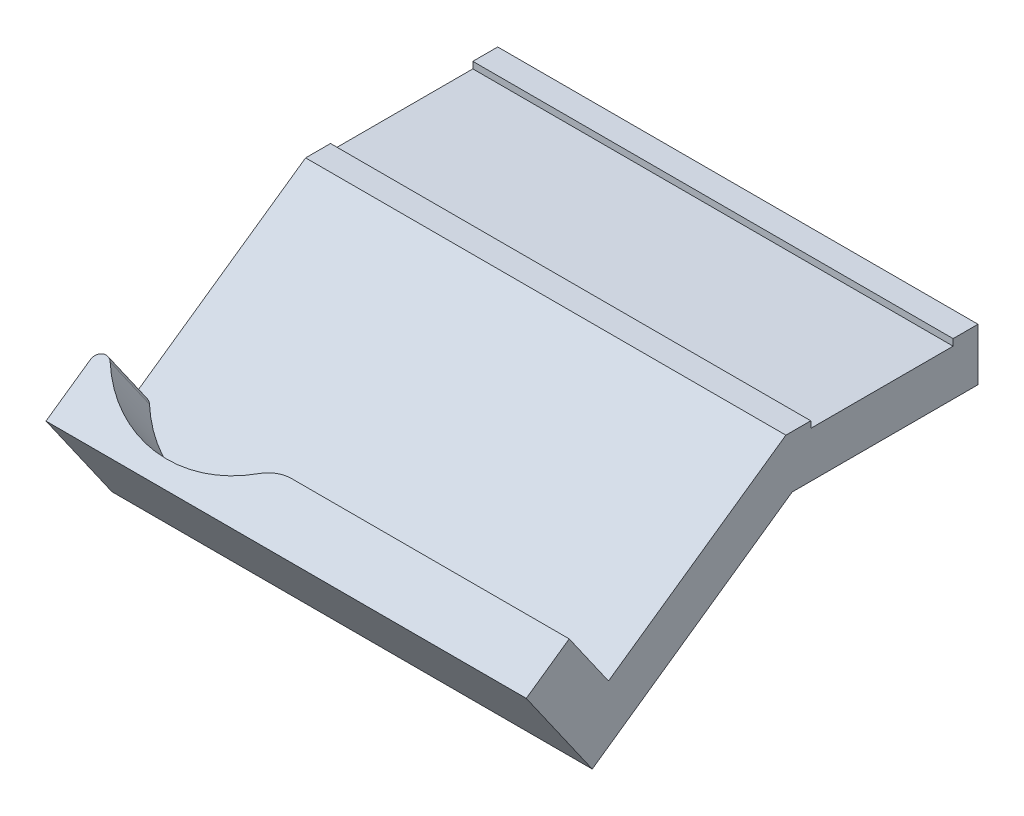
from build123d import *

# Parameters (mm, degrees)
SKETCH1_W           = 55
SKETCH1_H           = 33
BOSS_EXTRUDE1_DEPTH = 50
CUT_EXTRUDE1_DEPTH  = 50
CUT_EXTRUDE2_DEPTH  = 82.326502445
BOSS_EXTRUDE2_REACH = 83.327
SKETCH6_R           = 13.75
CUT_EXTRUDE3_DEPTH  = 81.295894003
CUT_EXTRUDE4_DEPTH  = 82.326502445
SKETCH8_R           = 6
CUT_EXTRUDE5_DEPTH  = 71.068140857
CUT_EXTRUDE6_DEPTH  = 71.068140857
SKETCH10_W          = 55
SKETCH10_H          = 4.5
CUT_EXTRUDE7_DEPTH  = 69.860192199
FILLET5_R           = 1
FILLET6_R           = 5
CUT_EXTRUDE8_DEPTH  = 67.820476425
SKETCH17_W          = 55
SKETCH17_H          = 6
BOSS_EXTRUDE4_DEPTH = 22
BOSS_EXTRUDE5_DEPTH = 55
SKETCH19_W          = 55
SKETCH19_H          = 16.3
CUT_EXTRUDE9_DEPTH  = 0.75
BOSS_EXTRUDE6_DEPTH = 55


with BuildPart() as part:
    # Sketch1 → Boss-Extrude1 (new body)
    with BuildSketch(Plane(origin=(0, 0, 0), x_dir=(1, 0, 0), z_dir=(0, 1, 0))):
        with Locations((27.5, 16.5)):
            Rectangle(SKETCH1_W, SKETCH1_H)
    extrude(amount=BOSS_EXTRUDE1_DEPTH)

    # Sketch4 → Cut-Extrude1 (cut)
    with BuildSketch(Plane(origin=(55, 0, 0), x_dir=(0, 0, -1), z_dir=(1, 0, 0))):
        Polygon((-21.678821818, 50.957602214), (19.278780397, 79.636424032), (47.957602214, 38.678821818), (7, 10), align=None)
    extrude(amount=-CUT_EXTRUDE1_DEPTH, mode=Mode.SUBTRACT)

    # Sketch5 → Cut-Extrude2 (cut, through all)
    with BuildSketch(Plane(origin=(55, 0, 0), x_dir=(0, 0, -1), z_dir=(1, 0, 0))):
        Polygon((-11.427284806, 18.88242211), (-3.235764364, 24.618186473), (2.5, 16.42666603), (-5.691520443, 10.690901667), align=None)
    extrude(amount=-CUT_EXTRUDE2_DEPTH, mode=Mode.SUBTRACT)

    # Sketch12 → Boss-Extrude2 (add, up to next)
    with BuildSketch(Plane(origin=(55, 0, 0), x_dir=(0, 0, -1), z_dir=(1, 0, 0)), mode=Mode.PRIVATE) as boss_extrude2_sk1:
        Polygon((2.5, 16.42666603), (7, 10), (8.187770464, 10.831685833), (3.687770464, 17.258351863), align=None)
    boss_extrude2_tool1 = extrude(boss_extrude2_sk1.sketch, amount=-BOSS_EXTRUDE2_REACH, mode=Mode.PRIVATE) - part.part
    add(boss_extrude2_tool1.solids().sort_by_distance((55, 13.629176, -5.343885))[0])

    # Sketch6 → Cut-Extrude3 (cut, through all)
    with BuildSketch(Plane(origin=(0, 3.421176544, 2.395533606), x_dir=(1, 0, 0), z_dir=(0, 0.8191520442889949, 0.5735764363510418))):
        with Locations((12, 22.917892202)):
            Circle(SKETCH6_R)
    extrude(amount=CUT_EXTRUDE3_DEPTH, mode=Mode.SUBTRACT)

    # Sketch7 → Cut-Extrude4 (cut, through all)
    with BuildSketch(Plane(origin=(55, 0, 0), x_dir=(0, 0, -1), z_dir=(1, 0, 0))):
        Polygon((0, 14.676147185), (6.378851002, 19.142666742), (10.878851002, 12.716000711), (85.085630618, 64.676147185), (25.408423261, 64.676147185), (0, 64.676147185), align=None)
    extrude(amount=-CUT_EXTRUDE4_DEPTH, mode=Mode.SUBTRACT)

    # Sketch8 → Cut-Extrude5 (cut, through all)
    with BuildSketch(Plane(origin=(0, 0, 0), x_dir=(1, 0, 0), z_dir=(0, 1, 0))):
        with Locations((25.75, 34.5)):
            Circle(SKETCH8_R)
    extrude(amount=CUT_EXTRUDE5_DEPTH, mode=Mode.SUBTRACT)

    # Sketch9 → Cut-Extrude6 (cut, through all)
    with BuildSketch(Plane(origin=(55, 0, 0), x_dir=(0, 0, -1), z_dir=(1, 0, 0))):
        Polygon((28.5, 25.054462072), (33, 25.054462072), (33, 28.205395993), align=None)
    extrude(amount=-CUT_EXTRUDE6_DEPTH, mode=Mode.SUBTRACT)

    # Sketch10 → Cut-Extrude7 (cut, through all)
    with BuildSketch(Plane(origin=(0, 0, 0), x_dir=(1, 0, 0), z_dir=(0, 1, 0))):
        with Locations((27.5, 30.75)):
            Rectangle(SKETCH10_W, SKETCH10_H)
    extrude(amount=CUT_EXTRUDE7_DEPTH, mode=Mode.SUBTRACT)

    # Fillet5
    fillet5_edges = [part.edges().sort_by_distance(p)[0] for p in [
        (0, 15.929333726, -8.628851002),
    ]]
    fillet(fillet5_edges, radius=FILLET5_R)

    # Fillet6
    fillet6_edges = [part.edges().sort_by_distance(p)[0] for p in [
        (21.439344558, 14.045018848, -5.937770464),
    ]]
    fillet(fillet6_edges, radius=FILLET6_R)

    # Sketch16 → Cut-Extrude8 (cut, through all)
    with BuildSketch(Plane(origin=(55, 0, 0), x_dir=(0, 0, -1), z_dir=(1, 0, 0))):
        Polygon((28.5, 18.554462072), (7.554001018, 3.887915689), (0, 14.676147185), (0, 0), (28.5, 0), align=None)
    extrude(amount=-CUT_EXTRUDE8_DEPTH, mode=Mode.SUBTRACT)

    # Sketch17 → Boss-Extrude4 (add)
    with BuildSketch(Plane(origin=(0, 0, -28.5), x_dir=(-1, 0, 0), z_dir=(0, 0, -1))):
        with Locations((-27.5, 22.054462072)):
            Rectangle(SKETCH17_W, SKETCH17_H)
    extrude(amount=BOSS_EXTRUDE4_DEPTH)

    # Sketch18 → Boss-Extrude5 (add)
    with BuildSketch(Plane(origin=(55, 0, 0), x_dir=(0, 0, -1), z_dir=(1, 0, 0))):
        Polygon((18.027000509, 11.22118888), (37.782962044, 25.054462072), (28.5, 25.054462072), (14.972999491, 15.582754346), align=None)
    extrude(amount=-BOSS_EXTRUDE5_DEPTH)

    # Sketch19 → Cut-Extrude9 (cut)
    with BuildSketch(Plane(origin=(0, 25.054462072, 0), x_dir=(1, 0, 0), z_dir=(0, 1, 0))):
        with Locations((27.5, 39.5)):
            Rectangle(SKETCH19_W, SKETCH19_H)
    extrude(amount=-CUT_EXTRUDE9_DEPTH, mode=Mode.SUBTRACT)

    # Sketch20 → Boss-Extrude6 (add)
    with BuildSketch(Plane(origin=(55, 0, 0), x_dir=(0, 0, -1), z_dir=(1, 0, 0))):
        Polygon((0, 14.676147185), (-1.228728066, 13.81578253), (6.325272951, 3.027551034), (7.554001018, 3.887915689), align=None)
    extrude(amount=-BOSS_EXTRUDE6_DEPTH)


solid = part.part
